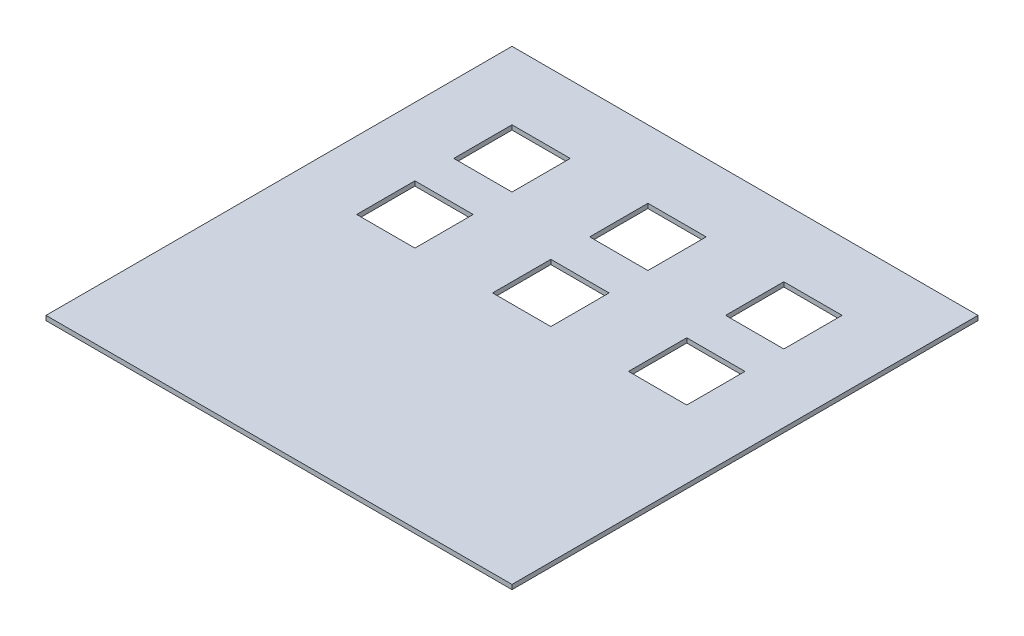
from build123d import *

# Parameters (mm, degrees)
SKETCH1_W            = 304.8
SKETCH1_H            = 304.8
BOSS_EXTRUDE1_DEPTH  = 2.9972
SKETCH2_W            = 38.1
SKETCH2_H            = 38.1
CUT_EXTRUDE1_DEPTH   = 2.9972
LPATTERN1_COUNT      = 3
LPATTERN1_PITCH      = 88.9
LPATTERN1_COUNT_DIR2 = 2
LPATTERN1_PITCH_DIR2 = 63.5


with BuildPart() as part:
    # Sketch1 → Boss-Extrude1 (new body)
    with BuildSketch(Plane(origin=(0, 0, 0), x_dir=(1, 0, 0), z_dir=(0, 1, 0))):
        Rectangle(SKETCH1_W, SKETCH1_H)
    extrude(amount=BOSS_EXTRUDE1_DEPTH)

    # Sketch2 → Cut-Extrude1 (cut)
    with BuildSketch(Plane(origin=(0, 2.9972, 0), x_dir=(1, 0, 0), z_dir=(0, 1, 0))):
        with Locations((-88.9, 88.9)):
            Rectangle(SKETCH2_W, SKETCH2_H)
    cut_extrude1 = extrude(amount=-CUT_EXTRUDE1_DEPTH, mode=Mode.SUBTRACT)

    # LPattern1: Cut-Extrude1 3 × 2
    with Locations(*[(i * LPATTERN1_PITCH, 0, j * LPATTERN1_PITCH_DIR2) for i in range(LPATTERN1_COUNT) for j in range(LPATTERN1_COUNT_DIR2) if (i, j) != (0, 0)]):
        add(cut_extrude1, mode=Mode.SUBTRACT)


solid = part.part
